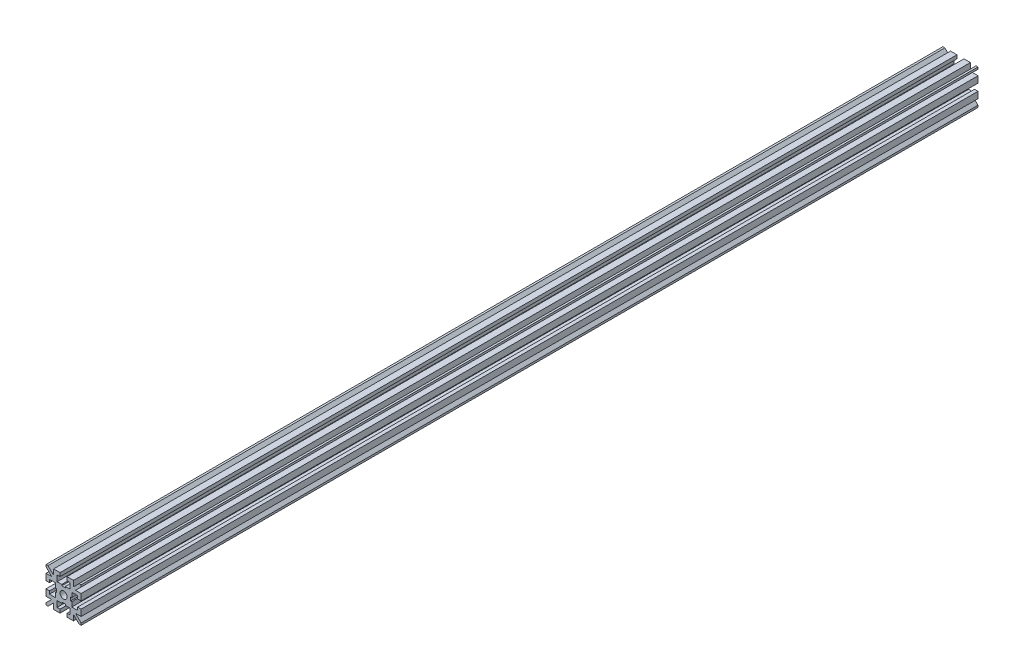
from build123d import *

# Parameters (mm, degrees)
SKETCH1_W           = 15
SKETCH1_H           = 15
BOSS_EXTRUDE1_DEPTH = 383
SKETCH2_R           = 1.5
CUT_EXTRUDE1_DEPTH  = 383
SKETCH3_W           = 3
SKETCH3_H           = 1.5
SKETCH3_W_2         = 1.5
SKETCH3_H_2         = 3
CUT_EXTRUDE2_DEPTH  = 383


with BuildPart() as part:
    # Sketch1 → Boss-Extrude1 (new body)
    with BuildSketch(Plane.XY):
        with Locations((-1.500578266, -3.738353388)):
            Rectangle(SKETCH1_W, SKETCH1_H)
    extrude(amount=BOSS_EXTRUDE1_DEPTH)

    # Sketch2 → Cut-Extrude1 (cut)
    with BuildSketch(Plane.XY.offset(383)):
        with Locations((-1.500578266, -3.738353388)):
            Circle(SKETCH2_R)
        Polygon((1.999421734, -4.488353388), (1.999421734, -6.488353388), (4.499421734, -6.488353388), (4.499421734, -0.988353388), (1.999421734, -0.988353388), (1.999421734, -2.988353388), (1.499421734, -2.988353388), (1.499421734, -4.488353388), align=None)
        Polygon((-4.250578266, -7.238353388), (-4.250578266, -9.738353388), (1.249421734, -9.738353388), (1.249421734, -7.238353388), (-0.750578266, -7.238353388), (-0.750578266, -6.738353388), (-2.250578266, -6.738353388), (-2.250578266, -7.238353388), align=None)
        Polygon((-5.000578266, -0.988353388), (-7.500578266, -0.988353388), (-7.500578266, -6.488353388), (-5.000578266, -6.488353388), (-5.000578266, -4.488353388), (-4.500578266, -4.488353388), (-4.500578266, -2.988353388), (-5.000578266, -2.988353388), align=None)
        Polygon((1.249421734, -0.238353388), (1.249421734, 2.261646612), (-4.250578266, 2.261646612), (-4.250578266, -0.238353388), (-2.250578266, -0.238353388), (-2.250578266, -0.738353388), (-0.750578266, -0.738353388), (-0.750578266, -0.238353388), align=None)
    extrude(amount=-CUT_EXTRUDE1_DEPTH, mode=Mode.SUBTRACT)

    # Sketch3 → Cut-Extrude2 (cut)
    with BuildSketch(Plane.XY.offset(383)):
        Polygon((5.150893596, 3.761646612), (2.749421734, 1.360174749), (2.749421734, 3.761646612), align=None)
        Polygon((5.999421734, 0.511646612), (5.999421734, 2.913118474), (3.597949871, 0.511646612), align=None)
        with Locations((-1.500578266, 3.011646612)):
            Rectangle(SKETCH3_W, SKETCH3_H)
        Polygon((2.749421734, -8.836881526), (2.749421734, -11.238353388), (5.150893596, -11.238353388), align=None)
        Polygon((5.999421734, -10.389825251), (3.597949871, -7.988353388), (5.999421734, -7.988353388), align=None)
        with Locations((5.249421734, -3.738353388)):
            Rectangle(SKETCH3_W_2, SKETCH3_H_2)
        Polygon((-6.599106404, -7.988353388), (-9.000578266, -7.988353388), (-9.000578266, -10.389825251), align=None)
        Polygon((-8.152050129, -11.238353388), (-5.750578266, -8.836881526), (-5.750578266, -11.238353388), align=None)
        with Locations((-1.500578266, -10.488353388)):
            Rectangle(SKETCH3_W, SKETCH3_H)
        Polygon((-5.750578266, 1.360174749), (-5.750578266, 3.761646612), (-8.152050129, 3.761646612), align=None)
        Polygon((-9.000578266, 2.913118474), (-6.599106404, 0.511646612), (-9.000578266, 0.511646612), align=None)
        with Locations((-8.250578266, -3.738353388)):
            Rectangle(SKETCH3_W_2, SKETCH3_H_2)
    extrude(amount=-CUT_EXTRUDE2_DEPTH, mode=Mode.SUBTRACT)


solid = part.part
